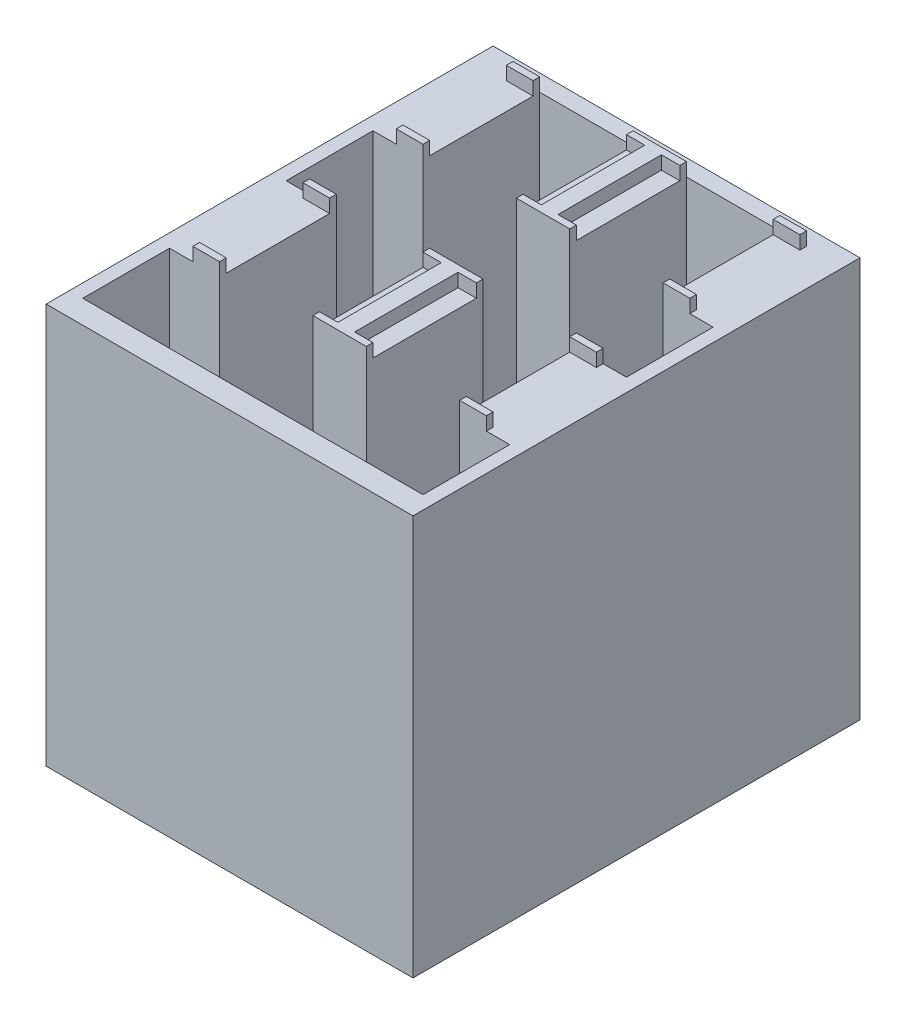
from build123d import *

# Parameters (mm, degrees)
SKETCH1_W           = 55
SKETCH1_H           = 67
BOSS_EXTRUDE1_DEPTH = 60
SKETCH3_W           = 8
SKETCH3_H           = 17.5
CUT_EXTRUDE3_DEPTH  = 58
SKETCH4_W           = 4
SKETCH4_H           = 1
SKETCH4_W_2         = 2.5
SKETCH4_H_2         = 15.5
SKETCH4_W_3         = 8
BOSS_EXTRUDE2_DEPTH = 2


with BuildPart() as part:
    # Sketch1 → Boss-Extrude1 (new body)
    with BuildSketch(Plane(origin=(0, 0, 0), x_dir=(1, 0, 0), z_dir=(0, 1, 0))):
        Rectangle(SKETCH1_W, SKETCH1_H)
    extrude(amount=BOSS_EXTRUDE1_DEPTH)

    # Sketch3 → Cut-Extrude3 (cut)
    with BuildSketch(Plane(origin=(0, 60, 0), x_dir=(1, 0, 0), z_dir=(0, 1, 0))):
        Polygon((-18, 13.5), (-18, 31), (-4, 31), (-4, 13.5), (4, 13.5), (4, 31), (18, 31), (18, 13.5), (25.5, 13.5), (25.5, 0.5), (18, 0.5), (18, -17), (25.5, -17), (25.5, -30), (-25.5, -30), (-25.5, -17), (-18, -17), (-18, 0.5), (-25.5, 0.5), (-25.5, 13.5), align=None)
        with Locations((0, -8.25)):
            Rectangle(SKETCH3_W, SKETCH3_H, mode=Mode.SUBTRACT)
    extrude(amount=-CUT_EXTRUDE3_DEPTH, mode=Mode.SUBTRACT)

    # Sketch4 → Boss-Extrude2 (add)
    with BuildSketch(Plane(origin=(0, 60, 0), x_dir=(1, 0, 0), z_dir=(0, 1, 0))):
        with Locations((-20, 30.5)):
            Rectangle(SKETCH4_W, SKETCH4_H)
        Polygon((4, 31), (-4, 31), (-4, 30), (-1.25, 30), (1.25, 30), (4, 30), align=None)
        with Locations((0, 22.25)):
            Rectangle(SKETCH4_W_2, SKETCH4_H_2)
        with Locations((20, 30.5)):
            Rectangle(SKETCH4_W, SKETCH4_H)
        with Locations((20, 14)):
            Rectangle(SKETCH4_W, SKETCH4_H)
        Polygon((-1.25, 14.5), (-4, 14.5), (-4, 13.5), (4, 13.5), (4, 14.5), (1.25, 14.5), align=None)
        with Locations((-20, 14)):
            Rectangle(SKETCH4_W, SKETCH4_H)
        with Locations((-20, 0)):
            Rectangle(SKETCH4_W, SKETCH4_H)
        Rectangle(SKETCH4_W_3, SKETCH4_H)
        with Locations((20, 0)):
            Rectangle(SKETCH4_W, SKETCH4_H)
        with Locations((20, -16.5)):
            Rectangle(SKETCH4_W, SKETCH4_H)
        with Locations((-20, -16.5)):
            Rectangle(SKETCH4_W, SKETCH4_H)
        with Locations((0, -16.5)):
            Rectangle(SKETCH4_W_3, SKETCH4_H)
        with Locations((0, -8.25)):
            Rectangle(SKETCH4_W_2, SKETCH4_H_2)
    extrude(amount=BOSS_EXTRUDE2_DEPTH)


solid = part.part
